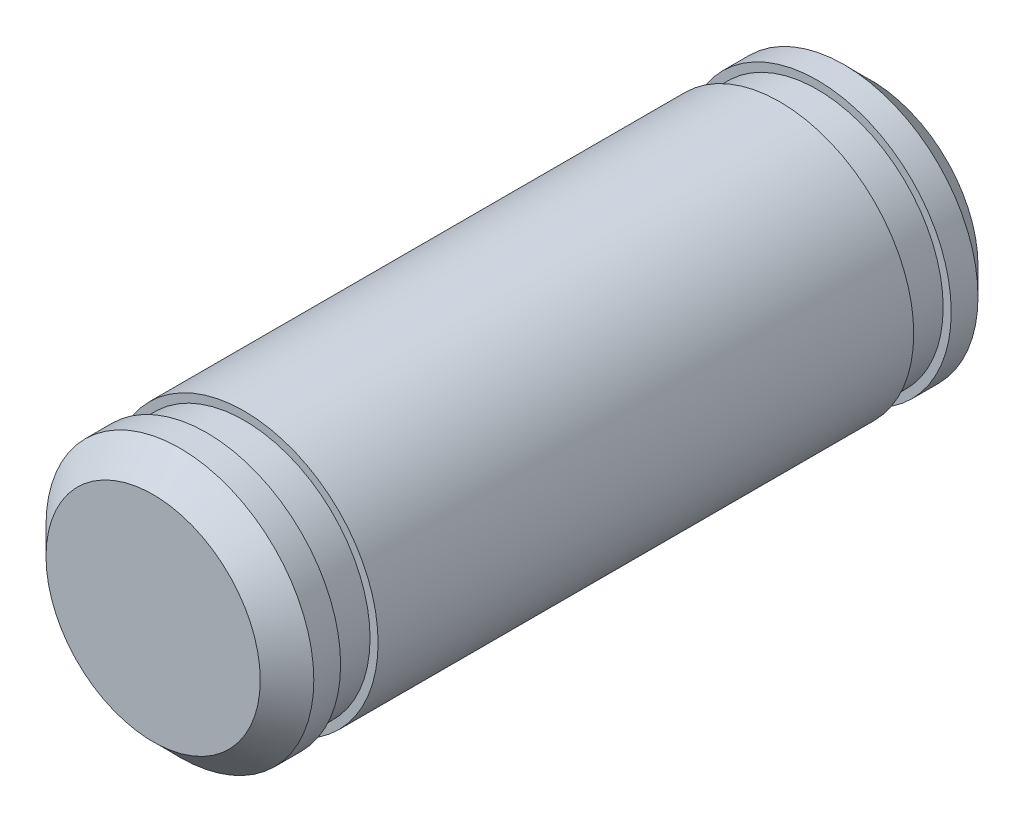
from build123d import *

# Parameters (mm, degrees)
SZKIC1_R                    = 2.5
DODANIE_WYCI_GNI_CIE1_DEPTH = 13.4
SFAZOWANIE1_SIZE            = 0.5
WYTNIJ_WYCI_GNI_CIE1_START  = -1.7
SZKIC2_R                    = 2.5
SZKIC2_R_2                  = 2.35
WYTNIJ_WYCI_GNI_CIE1_DEPTH  = 0.7
WYTNIJ_WYCI_GNI_CIE2_START  = -1
SZKIC3_R                    = 2.5
SZKIC3_R_2                  = 2.35
WYTNIJ_WYCI_GNI_CIE2_DEPTH  = 0.7


with BuildPart() as part:
    # Szkic1 → Dodanie-wyciągnięcie1 (new body)
    with BuildSketch(Plane.XY):
        Circle(SZKIC1_R)
    extrude(amount=DODANIE_WYCI_GNI_CIE1_DEPTH)

    # Sfazowanie1
    sfazowanie1_edges = [part.edges().sort_by_distance(p)[0] for p in [
        (-2.5, 0, 0),
        (-2.5, 0, 13.4),
    ]]
    chamfer(sfazowanie1_edges, length=SFAZOWANIE1_SIZE)

    # Szkic2 → Wytnij-wyciągnięcie1 (cut)
    with BuildSketch(Plane.XY.offset(13.4).offset(WYTNIJ_WYCI_GNI_CIE1_START)):
        Circle(SZKIC2_R)
        Circle(SZKIC2_R_2, mode=Mode.SUBTRACT)
    extrude(amount=WYTNIJ_WYCI_GNI_CIE1_DEPTH, mode=Mode.SUBTRACT)

    # Szkic3 → Wytnij-wyciągnięcie2 (cut)
    with BuildSketch(Plane(origin=(0, 0, 0), x_dir=(-1, 0, 0), z_dir=(0, 0, -1)).offset(WYTNIJ_WYCI_GNI_CIE2_START)):
        Circle(SZKIC3_R)
        with Locations(Location((0, 0, 0), (0, 0, 180))):
            Circle(SZKIC3_R_2, mode=Mode.SUBTRACT)
    extrude(amount=-WYTNIJ_WYCI_GNI_CIE2_DEPTH, mode=Mode.SUBTRACT)


solid = part.part
